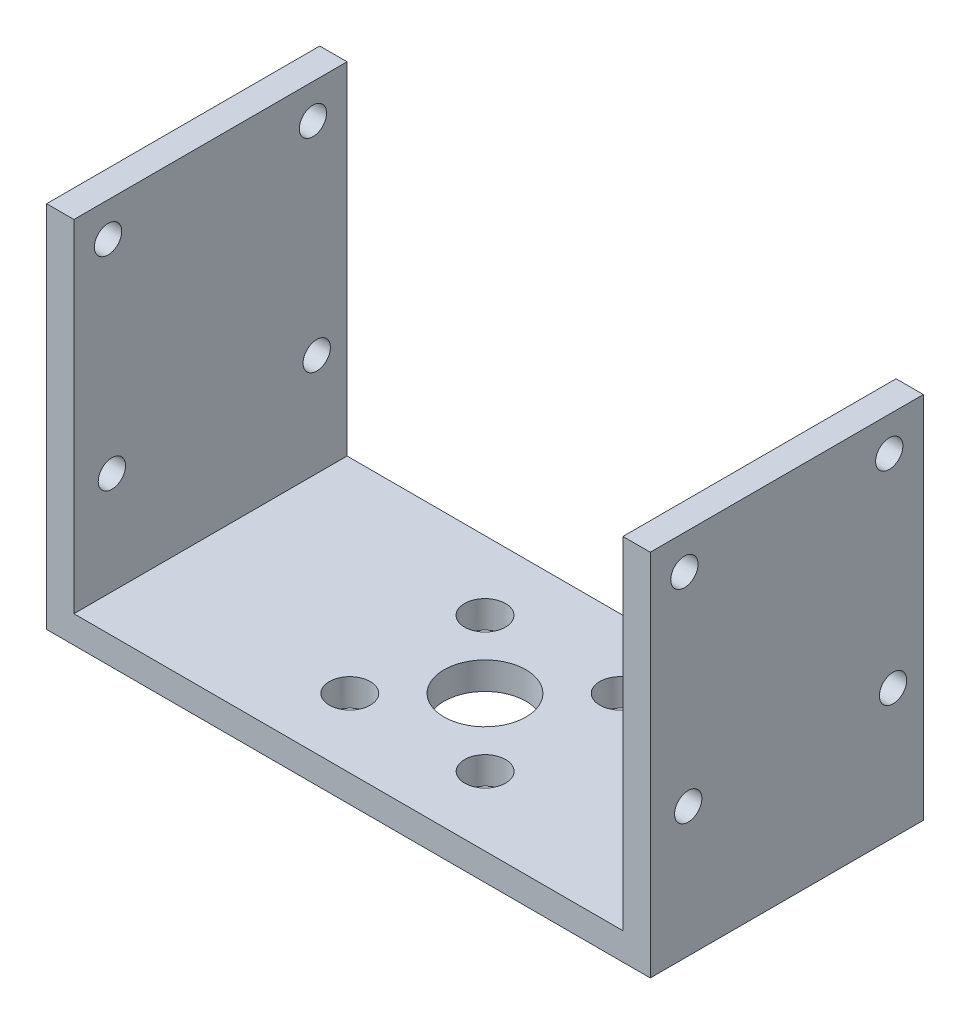
from build123d import *

# Parameters (mm, degrees)
SKETCH1_W           = 44.2
SKETCH1_H           = 20
BOSS_EXTRUDE1_DEPTH = 2
SKETCH2_W           = 2
SKETCH2_H           = 20
BOSS_EXTRUDE2_DEPTH = 25
SKETCH3_R           = 3
SKETCH3_R_2         = 1.5
CUT_EXTRUDE1_DEPTH  = 25
SKETCH5_R           = 1
CUT_EXTRUDE2_DEPTH  = 56.521527357


with BuildPart() as part:
    # Sketch1 → Boss-Extrude1 (new body)
    with BuildSketch(Plane(origin=(0, 0, 0), x_dir=(1, 0, 0), z_dir=(0, 1, 0))):
        with Locations((22.1, 10)):
            Rectangle(SKETCH1_W, SKETCH1_H)
    extrude(amount=BOSS_EXTRUDE1_DEPTH)

    # Sketch2 → Boss-Extrude2 (add)
    with BuildSketch(Plane(origin=(0, 2, 0), x_dir=(1, 0, 0), z_dir=(0, 1, 0))):
        with Locations((1, 10)):
            Rectangle(SKETCH2_W, SKETCH2_H)
        with Locations((43.2, 10)):
            Rectangle(SKETCH2_W, SKETCH2_H)
    extrude(amount=BOSS_EXTRUDE2_DEPTH)

    # Sketch3 → Cut-Extrude1 (cut)
    with BuildSketch(Plane(origin=(0, 2, 0), x_dir=(1, 0, 0), z_dir=(0, 1, 0))):
        with Locations(Location((22.1, 10, 0), (0, 0, 270))):
            Circle(SKETCH3_R)
        with Locations(Location((17.1505, 14.9495, 0), (0, 0, 270))):
            Circle(SKETCH3_R_2)
        with Locations(Location((17.1505, 5.0505, 0), (0, 0, 270))):
            Circle(SKETCH3_R_2)
        with Locations(Location((27.0495, 5.0595, 0), (0, 0, 270))):
            Circle(SKETCH3_R_2)
        with Locations(Location((27.0495, 14.9495, 0), (0, 0, 270))):
            Circle(SKETCH3_R_2)
    extrude(amount=-CUT_EXTRUDE1_DEPTH, mode=Mode.SUBTRACT)

    # Sketch5 → Cut-Extrude2 (cut, through all)
    with BuildSketch(Plane.ZY):
        with Locations((-2.5, 24.5)):
            Circle(SKETCH5_R)
        with Locations((-2.779646808, 9.5)):
            Circle(SKETCH5_R)
        with Locations((-17.5, 24.5)):
            Circle(SKETCH5_R)
        with Locations((-17.779646808, 9.5)):
            Circle(SKETCH5_R)
    extrude(amount=-CUT_EXTRUDE2_DEPTH, mode=Mode.SUBTRACT)


solid = part.part
